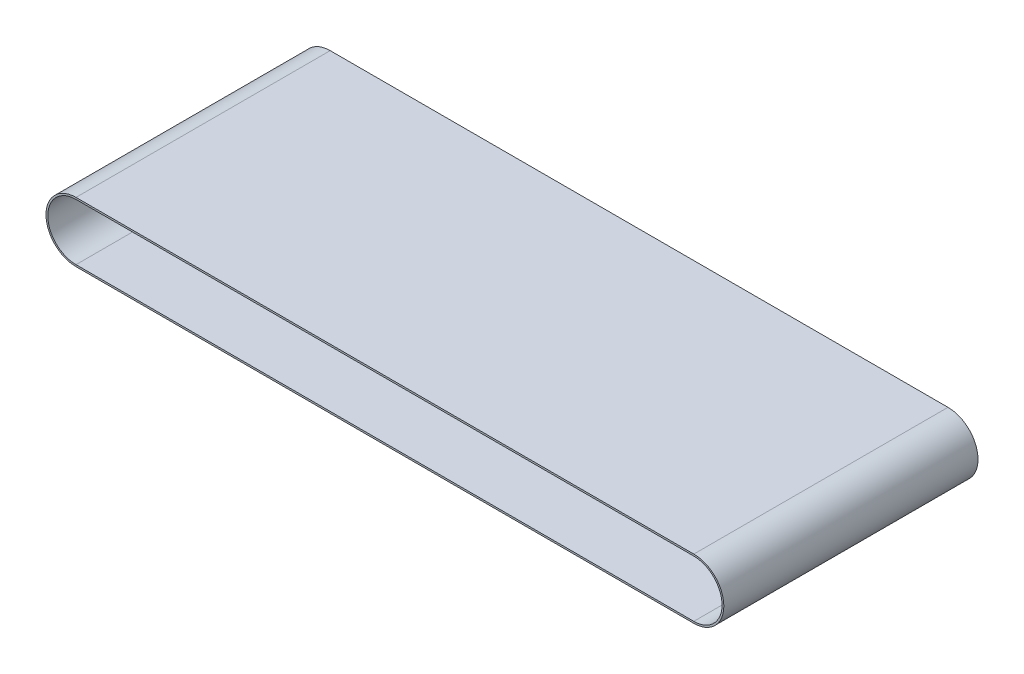
from build123d import *

# Parameters (mm, degrees)
BOSS_EXTRUDE1_DEPTH = 114.3
CUT_EXTRUDE1_DEPTH  = 627.437235733


with BuildPart() as part:
    # Sketch1 → Boss-Extrude1 (new, symmetric)
    with BuildSketch(Plane.XY):
        with BuildLine():
            Line((0, 26.9875), (555.625, 26.9875))
            ThreePointArc((555.625, 26.9875), (582.6125, 0), (555.625, -26.9875))
            Line((555.625, -26.9875), (0, -26.9875))
            ThreePointArc((0, -26.9875), (-26.9875, 0), (0, 26.9875))
        make_face()
    extrude(amount=BOSS_EXTRUDE1_DEPTH, both=True)

    # Sketch3 → Cut-Extrude1 (cut, through all)
    with BuildSketch(Plane.XY.offset(114.3)):
        with BuildLine():
            Line((0, 25.4), (555.625, 25.4))
            ThreePointArc((555.625, 25.4), (581.025, 0), (555.625, -25.4))
            Line((555.625, -25.4), (0, -25.4))
            ThreePointArc((0, -25.4), (-25.4, 0), (0, 25.4))
        make_face()
    extrude(amount=-CUT_EXTRUDE1_DEPTH, mode=Mode.SUBTRACT)


solid = part.part
